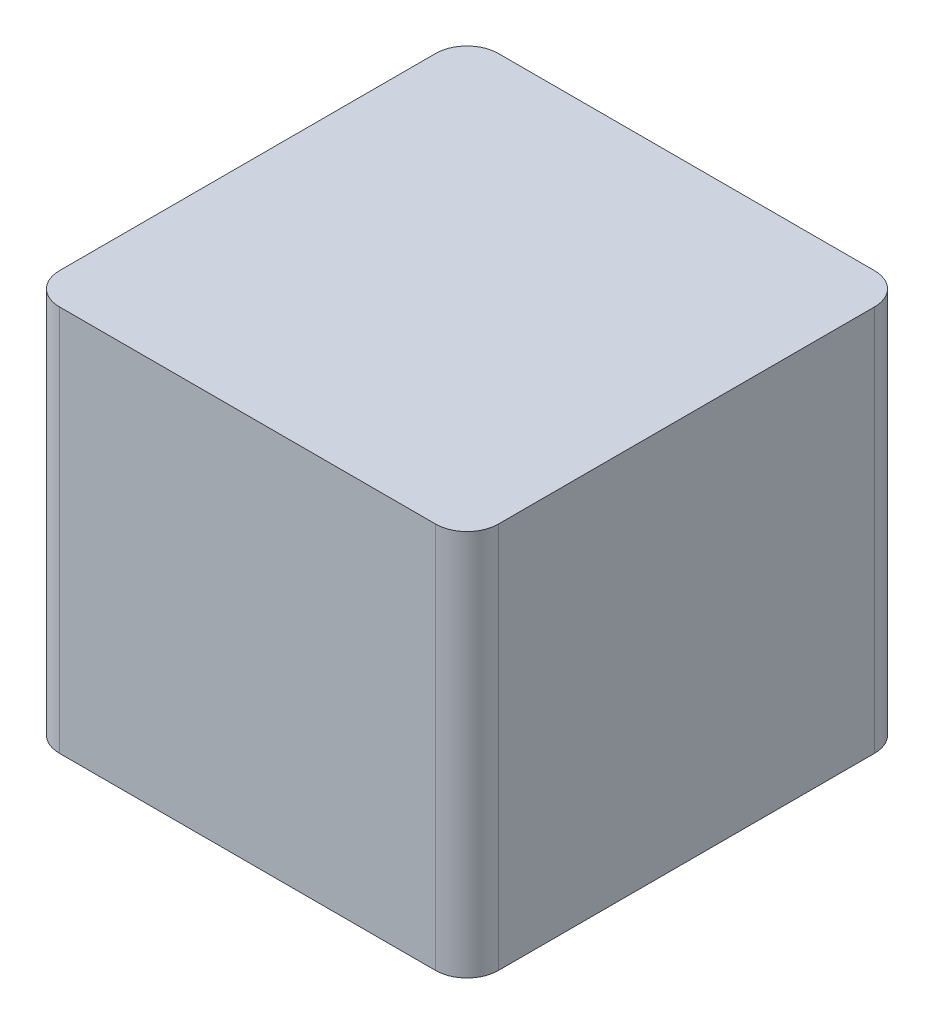
from build123d import *

# Parameters (mm, degrees)
SKETCH_1_W         = 42
SKETCH_1_H         = 37
BLOCKEXTRUDE_DEPTH = 42
FILLET_2_R         = 3


with BuildPart() as part:
    # 草图1 → BlockExtrude (new body)
    with BuildSketch(Plane.XY):
        with Locations((21, 18.5)):
            Rectangle(SKETCH_1_W, SKETCH_1_H)
    extrude(amount=BLOCKEXTRUDE_DEPTH)

    # Fillet 2
    fillet_2_edges = [part.edges().sort_by_distance(p)[0] for p in [
        (42, 18.5, 42),
        (0, 18.5, 42),
        (42, 18.5, 0),
        (0, 18.5, 0),
    ]]
    fillet(fillet_2_edges, radius=FILLET_2_R)


solid = part.part
